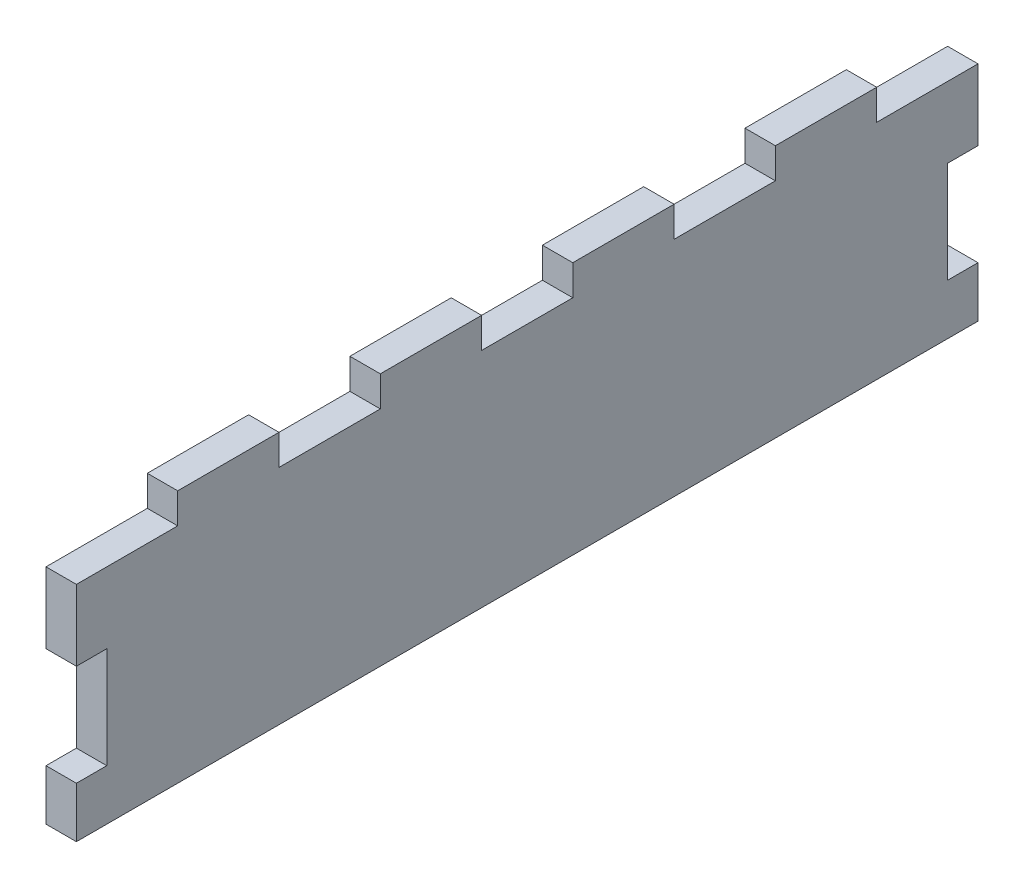
from build123d import *

# Parameters (mm, degrees)
BOSS_EXTRUDE1_DEPTH = 3


with BuildPart() as part:
    # Sketch1 → Boss-Extrude1 (new body)
    with BuildSketch(Plane(origin=(0, 0, 0), x_dir=(0, 0, -1), z_dir=(1, 0, 0))):
        Polygon((0, 15), (0, 22), (10, 22), (10, 25), (20, 25), (20, 22), (30, 22), (30, 25), (40, 25), (40, 22), (49, 22), (49, 25), (59, 25), (59, 22), (69, 22), (69, 25), (79, 25), (79, 22), (89, 22), (89, 15), (86, 15), (86, 5), (89, 5), (89, 0), (0, 0), (0, 5), (3, 5), (3, 15), align=None)
    extrude(amount=BOSS_EXTRUDE1_DEPTH)


solid = part.part
